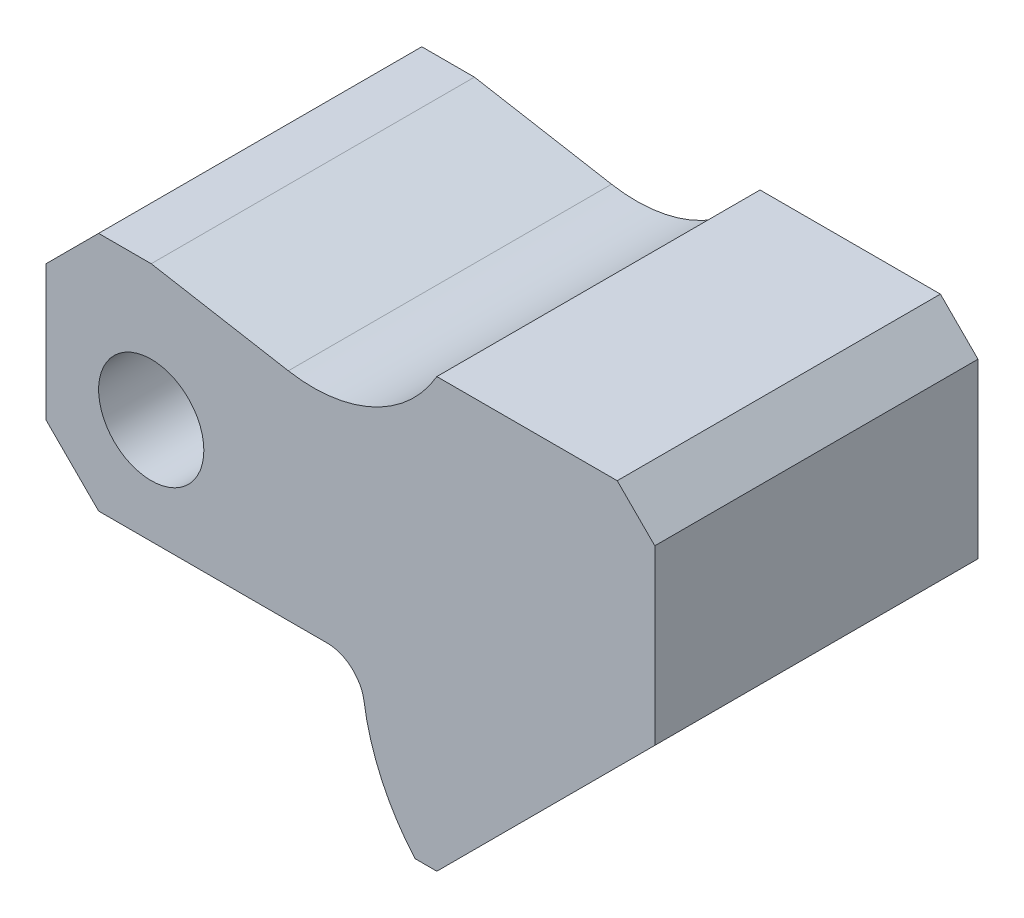
from build123d import *

# Parameters (mm, degrees)
SKETCH1_R           = 7
BOSS_EXTRUDE2_DEPTH = 43


with BuildPart() as part:
    # Sketch1 → Boss-Extrude2 (new body)
    with BuildSketch(Plane.XY):
        with BuildLine():
            Line((0, 0), (7, 7))
            Line((7, 7), (14, 7))
            Line((14, 7), (32.243084988, 3.783251905))
            ThreePointArc((32.243084988, 3.783251905), (43.574972961, 5.276069151), (52, 13))
            Line((52, 13), (76, 13))
            Line((76, 13), (81, 8))
            Line((81, 8), (81, -15))
            Line((81, -15), (52, -44))
            Line((52, -44), (49.0910977, -44))
            ThreePointArc((49.0910977, -44), (44.652125503, -37.115672061), (42.3152953, -29.264705882))
            ThreePointArc((42.3152953, -29.264705882), (40.634892339, -26.213413768), (37.369656558, -25))
            Line((37.369656558, -25), (7, -25))
            Line((7, -25), (0, -18))
            Line((0, -18), (0, 0))
        make_face()
        with Locations((14, -11)):
            Circle(SKETCH1_R, mode=Mode.SUBTRACT)
    extrude(amount=BOSS_EXTRUDE2_DEPTH)


solid = part.part
